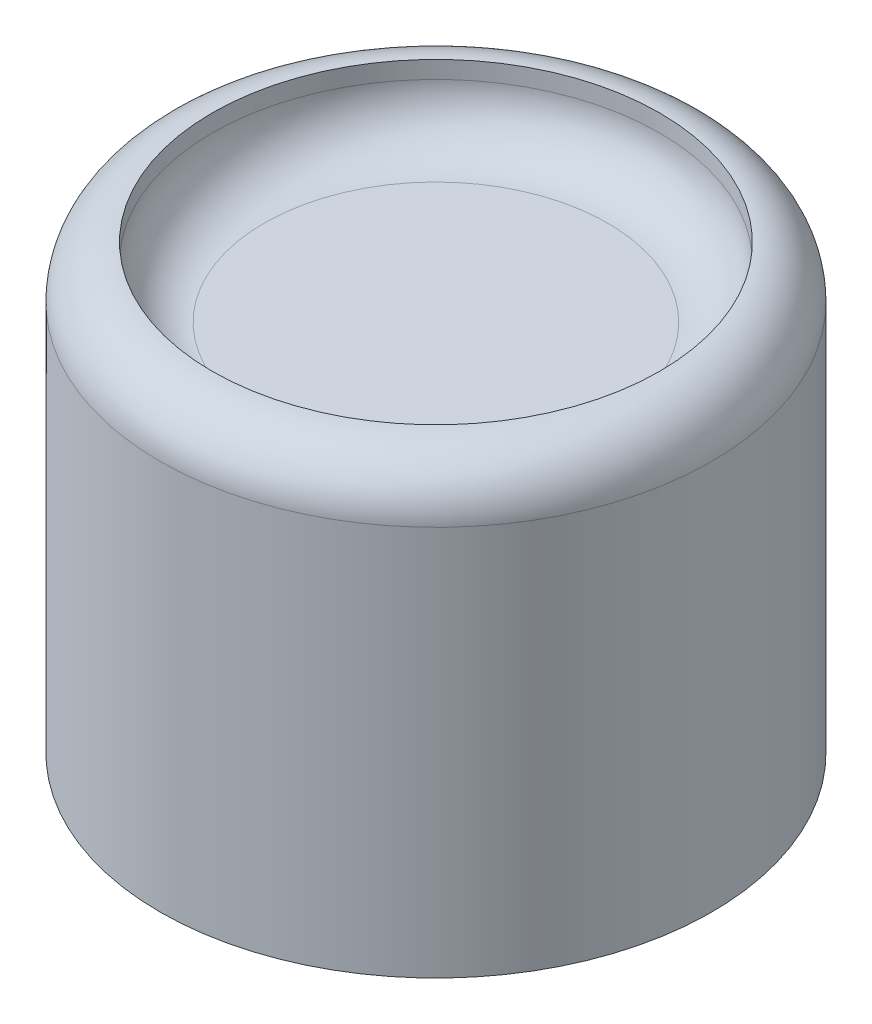
from build123d import *

# Parameters (mm, degrees)
SKETCH1_R           = 7.95
BOSS_EXTRUDE1_DEPTH = 12.75
FILLET1_R           = 1.5
SKETCH2_R           = 6.45
CUT_EXTRUDE1_DEPTH  = 2
FILLET2_R           = 1.5


with BuildPart() as part:
    # Sketch1 → Boss-Extrude1 (new body)
    with BuildSketch(Plane(origin=(0, 0, 0), x_dir=(1, 0, 0), z_dir=(0, 1, 0))):
        with Locations(Location((0, 0, 0), (0, 0, 270))):
            Circle(SKETCH1_R)
    extrude(amount=BOSS_EXTRUDE1_DEPTH)

    # Fillet1
    fillet1_edges = [part.edges().sort_by_distance(p)[0] for p in [
        (0, 12.75, -7.95),
    ]]
    fillet(fillet1_edges, radius=FILLET1_R)

    # Sketch2 → Cut-Extrude1 (cut)
    with BuildSketch(Plane(origin=(0, 12.75, 0), x_dir=(1, 0, 0), z_dir=(0, 1, 0))):
        with Locations(Location((0, 0, 0), (0, 0, 270))):
            Circle(SKETCH2_R)
    extrude(amount=-CUT_EXTRUDE1_DEPTH, mode=Mode.SUBTRACT)

    # Fillet2
    fillet2_edges = [part.edges().sort_by_distance(p)[0] for p in [
        (0, 10.75, -6.45),
    ]]
    fillet(fillet2_edges, radius=FILLET2_R)


solid = part.part
